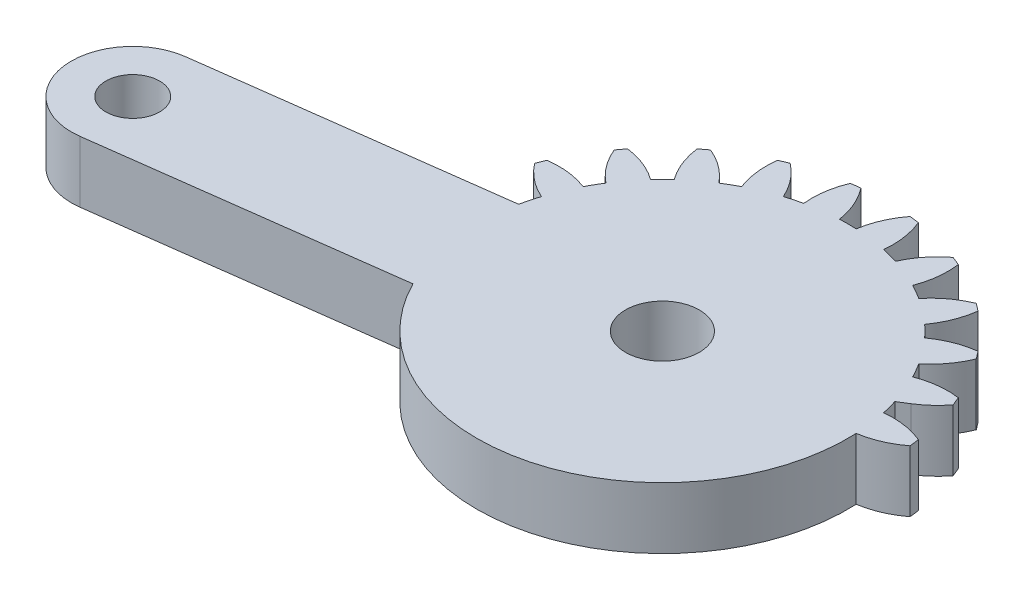
from build123d import *
from build123d.topology import SkipClean

# Parameters (mm, degrees)
SKETCH1_R           = 1.5
BOSS_EXTRUDE1_DEPTH = 4
SKETCH3_R           = 1.75
BOSS_EXTRUDE2_DEPTH = 4
CUT_EXTRUDE1_START  = -4
CUT_EXTRUDE1_DEPTH  = 4
CUT_EXTRUDE2_REACH  = 49.073
SKETCH5_R           = 2.4


with BuildPart() as part:
    # Sketch1 → Boss-Extrude1 (new body)
    with BuildSketch(Plane(origin=(0, 0, 0), x_dir=(1, 0, 0), z_dir=(0, 1, 0))):
        with BuildLine():
            Line((20.643657446, 4), (2.081641936, 4))
            ThreePointArc((2.081641936, 4), (2.861028333, 4.588201733), (3.521749436, 5.30713988))
            ThreePointArc((3.521749436, 5.30713988), (3.405395609, 5.596745198), (3.282888305, 5.883801663))
            ThreePointArc((3.282888305, 5.883801663), (1.93527598, 5.894040025), (0.627094961, 5.57027124))
            ThreePointArc((0.627094961, 5.57027124), (0.366286148, 6.046375), (0.084372603, 6.510293938))
            ThreePointArc((0.084372603, 6.510293938), (1.018855105, 7.48132754), (1.683794586, 8.65351323))
            ThreePointArc((1.683794586, 8.65351323), (1.496450048, 8.903135899), (1.303821399, 9.148703928))
            ThreePointArc((1.303821399, 9.148703928), (-0.000522033, 8.809805691), (-1.180330337, 8.158486898))
            ThreePointArc((-1.180330337, 8.158486898), (-1.555477026, 8.550865528), (-1.947855656, 8.926012217))
            ThreePointArc((-1.947855656, 8.926012217), (-1.296536862, 10.105820521), (-0.957638625, 11.410163953))
            ThreePointArc((-0.957638625, 11.410163953), (-1.203206655, 11.602792602), (-1.452829324, 11.79013714))
            ThreePointArc((-1.452829324, 11.79013714), (-2.625015014, 11.125197659), (-3.596048616, 10.190715157))
            ThreePointArc((-3.596048616, 10.190715157), (-4.059967554, 10.472628702), (-4.536071314, 10.733437515))
            ThreePointArc((-4.536071314, 10.733437515), (-4.212302529, 12.041618533), (-4.222540891, 13.389230859))
            ThreePointArc((-4.222540891, 13.389230859), (-4.509597355, 13.511738163), (-4.799202674, 13.62809199))
            ThreePointArc((-4.799202674, 13.62809199), (-5.759348103, 12.682425791), (-6.455432668, 11.528463019))
            ThreePointArc((-6.455432668, 11.528463019), (-6.976508546, 11.680699536), (-7.503891752, 11.809396783))
            ThreePointArc((-7.503891752, 11.809396783), (-7.529737283, 13.156800143), (-7.888414517, 14.455843809))
            ThreePointArc((-7.888414517, 14.455843809), (-8.197396993, 14.499881098), (-8.507248835, 14.537314892))
            ThreePointArc((-8.507248835, 14.537314892), (-9.18992168, 13.375367565), (-9.563620196, 12.080565177))
            ThreePointArc((-9.563620196, 12.080565177), (-10.106342554, 12.09275), (-10.649064912, 12.080565177))
            ThreePointArc((-10.649064912, 12.080565177), (-11.022763428, 13.375367565), (-11.705436272, 14.537314892))
            ThreePointArc((-11.705436272, 14.537314892), (-12.015288115, 14.499881098), (-12.324270591, 14.455843809))
            ThreePointArc((-12.324270591, 14.455843809), (-12.682947825, 13.156800143), (-12.708793355, 11.809396783))
            ThreePointArc((-12.708793355, 11.809396783), (-13.236176561, 11.680699536), (-13.757252439, 11.528463019))
            ThreePointArc((-13.757252439, 11.528463019), (-14.453337005, 12.682425791), (-15.413482434, 13.62809199))
            ThreePointArc((-15.413482434, 13.62809199), (-15.703087752, 13.511738163), (-15.990144217, 13.389230859))
            ThreePointArc((-15.990144217, 13.389230859), (-16.000382579, 12.041618533), (-15.676613793, 10.733437515))
            ThreePointArc((-15.676613793, 10.733437515), (-16.152717554, 10.472628702), (-16.616636492, 10.190715157))
            ThreePointArc((-16.616636492, 10.190715157), (-17.587670094, 11.125197659), (-18.759855783, 11.79013714))
            ThreePointArc((-18.759855783, 11.79013714), (-19.009478453, 11.602792602), (-19.255046482, 11.410163953))
            ThreePointArc((-19.255046482, 11.410163953), (-18.916148245, 10.105820521), (-18.264829452, 8.926012217))
            ThreePointArc((-18.264829452, 8.926012217), (-18.657208082, 8.550865528), (-19.032354771, 8.158486898))
            ThreePointArc((-19.032354771, 8.158486898), (-20.212163074, 8.809805691), (-21.516506507, 9.148703928))
            ThreePointArc((-21.516506507, 9.148703928), (-21.709135156, 8.903135899), (-21.896479694, 8.65351323))
            ThreePointArc((-21.896479694, 8.65351323), (-21.231540213, 7.48132754), (-20.297057711, 6.510293938))
            ThreePointArc((-20.297057711, 6.510293938), (-20.578971255, 6.046375), (-20.839780068, 5.57027124))
            ThreePointArc((-20.839780068, 5.57027124), (-22.147961087, 5.894040025), (-23.495573413, 5.883801663))
            ThreePointArc((-23.495573413, 5.883801663), (-23.618080717, 5.596745198), (-23.734434544, 5.30713988))
            ThreePointArc((-23.734434544, 5.30713988), (-22.788768345, 4.346994451), (-21.634805572, 3.650909885))
            ThreePointArc((-21.634805572, 3.650909885), (-21.78704209, 3.129834008), (-21.915739337, 2.602450802))
            ThreePointArc((-21.915739337, 2.602450802), (-23.263142697, 2.576605271), (-24.562186363, 2.217928037))
            ThreePointArc((-24.562186363, 2.217928037), (-24.606223651, 1.908945561), (-24.643657446, 1.599093719))
            ThreePointArc((-24.643657446, 1.599093719), (-23.481710119, 0.916420874), (-22.186907731, 0.542722358))
            ThreePointArc((-22.186907731, 0.542722358), (-22.199092554, 0), (-22.186907731, -0.542722358))
            ThreePointArc((-22.186907731, -0.542722358), (-23.481710119, -0.916420874), (-24.643657446, -1.599093719))
            ThreePointArc((-24.643657446, -1.599093719), (-24.606223651, -1.908945561), (-24.562186363, -2.217928037))
            ThreePointArc((-24.562186363, -2.217928037), (-23.263142697, -2.576605271), (-21.915739337, -2.602450802))
            ThreePointArc((-21.915739337, -2.602450802), (-21.78704209, -3.129834008), (-21.634805572, -3.650909885))
            ThreePointArc((-21.634805572, -3.650909885), (-22.788768345, -4.346994451), (-23.734434544, -5.30713988))
            ThreePointArc((-23.734434544, -5.30713988), (-23.618080717, -5.596745198), (-23.495573413, -5.883801663))
            ThreePointArc((-23.495573413, -5.883801663), (-22.147961087, -5.894040025), (-20.839780068, -5.57027124))
            ThreePointArc((-20.839780068, -5.57027124), (-20.578971255, -6.046375), (-20.297057711, -6.510293938))
            ThreePointArc((-20.297057711, -6.510293938), (-21.231540213, -7.48132754), (-21.896479694, -8.65351323))
            ThreePointArc((-21.896479694, -8.65351323), (-21.709135156, -8.903135899), (-21.516506507, -9.148703928))
            ThreePointArc((-21.516506507, -9.148703928), (-20.212163074, -8.809805691), (-19.032354771, -8.158486898))
            ThreePointArc((-19.032354771, -8.158486898), (-18.657208082, -8.550865528), (-18.264829452, -8.926012217))
            ThreePointArc((-18.264829452, -8.926012217), (-18.916148245, -10.105820521), (-19.255046482, -11.410163953))
            ThreePointArc((-19.255046482, -11.410163953), (-19.009478453, -11.602792602), (-18.759855783, -11.79013714))
            ThreePointArc((-18.759855783, -11.79013714), (-17.587670094, -11.125197659), (-16.616636492, -10.190715157))
            ThreePointArc((-16.616636492, -10.190715157), (-16.152717554, -10.472628702), (-15.676613793, -10.733437515))
            ThreePointArc((-15.676613793, -10.733437515), (-16.000382579, -12.041618533), (-15.990144217, -13.389230859))
            ThreePointArc((-15.990144217, -13.389230859), (-15.703087752, -13.511738163), (-15.413482434, -13.62809199))
            ThreePointArc((-15.413482434, -13.62809199), (-14.453337005, -12.682425791), (-13.757252439, -11.528463019))
            ThreePointArc((-13.757252439, -11.528463019), (-13.236176561, -11.680699536), (-12.708793355, -11.809396783))
            ThreePointArc((-12.708793355, -11.809396783), (-12.682947825, -13.156800143), (-12.324270591, -14.455843809))
            ThreePointArc((-12.324270591, -14.455843809), (-12.015288115, -14.499881098), (-11.705436272, -14.537314892))
            ThreePointArc((-11.705436272, -14.537314892), (-11.022763428, -13.375367565), (-10.649064912, -12.080565177))
            ThreePointArc((-10.649064912, -12.080565177), (-10.106342554, -12.09275), (-9.563620196, -12.080565177))
            ThreePointArc((-9.563620196, -12.080565177), (-9.18992168, -13.375367565), (-8.507248835, -14.537314892))
            ThreePointArc((-8.507248835, -14.537314892), (-8.197396993, -14.499881098), (-7.888414517, -14.455843809))
            ThreePointArc((-7.888414517, -14.455843809), (-7.529737283, -13.156800143), (-7.503891752, -11.809396783))
            ThreePointArc((-7.503891752, -11.809396783), (-6.976508546, -11.680699536), (-6.455432668, -11.528463019))
            ThreePointArc((-6.455432668, -11.528463019), (-5.759348103, -12.682425791), (-4.799202674, -13.62809199))
            ThreePointArc((-4.799202674, -13.62809199), (-4.509597355, -13.511738163), (-4.222540891, -13.389230859))
            ThreePointArc((-4.222540891, -13.389230859), (-4.212302529, -12.041618533), (-4.536071314, -10.733437515))
            ThreePointArc((-4.536071314, -10.733437515), (-4.059967554, -10.472628702), (-3.596048616, -10.190715157))
            ThreePointArc((-3.596048616, -10.190715157), (-2.625015014, -11.125197659), (-1.452829324, -11.79013714))
            ThreePointArc((-1.452829324, -11.79013714), (-1.203206655, -11.602792602), (-0.957638625, -11.410163953))
            ThreePointArc((-0.957638625, -11.410163953), (-1.296536862, -10.105820521), (-1.947855656, -8.926012217))
            ThreePointArc((-1.947855656, -8.926012217), (-1.555477026, -8.550865528), (-1.180330337, -8.158486898))
            ThreePointArc((-1.180330337, -8.158486898), (-0.000522033, -8.809805691), (1.303821399, -9.148703928))
            ThreePointArc((1.303821399, -9.148703928), (1.496450048, -8.903135899), (1.683794586, -8.65351323))
            ThreePointArc((1.683794586, -8.65351323), (1.018855105, -7.48132754), (0.084372603, -6.510293938))
            ThreePointArc((0.084372603, -6.510293938), (0.366286148, -6.046375), (0.627094961, -5.57027124))
            ThreePointArc((0.627094961, -5.57027124), (1.93527598, -5.894040025), (3.282888305, -5.883801663))
            ThreePointArc((3.282888305, -5.883801663), (3.405395609, -5.596745198), (3.521749436, -5.30713988))
            ThreePointArc((3.521749436, -5.30713988), (2.861028333, -4.588201733), (2.081641936, -4))
            Line((2.081641936, -4), (20.643657446, -4))
            ThreePointArc((20.643657446, -4), (24.643657446, 0), (20.643657446, 4))
        make_face()
        with Locations(Location((-10.106342554, 0, 0), (0, 0, 270))):
            Circle(SKETCH1_R, mode=Mode.SUBTRACT)
        with Locations(Location((20.643657446, 0, 0), (0, 0, 270))):
            Circle(SKETCH1_R, mode=Mode.SUBTRACT)
    extrude(amount=BOSS_EXTRUDE1_DEPTH)

    # Sketch3 → Boss-Extrude2 (add)
    with BuildSketch(Plane(origin=(0, 4, 0), x_dir=(1, 0, 0), z_dir=(0, 1, 0))):
        with BuildLine():
            ThreePointArc((-9.584237785, -3.965779445), (-14.072121999, -0.522104769), (-10.628447323, 3.965779445))
            Line((-10.628447323, 3.965779445), (-41.11537681, -0.047900965))
            ThreePointArc((-41.11537681, -0.047900965), (-44.559051487, -4.53578518), (-40.071167272, -7.979459856))
            Line((-40.071167272, -7.979459856), (-9.584237785, -3.965779445))
        make_face()
        with Locations(Location((-40.593272041, -4.013680411, 0), (0, 0, 270))):
            Circle(SKETCH3_R, mode=Mode.SUBTRACT)
    extrude(amount=-BOSS_EXTRUDE2_DEPTH)

    # Sketch4 → Cut-Extrude1 (cut)
    with SkipClean():  # the faces are left unmerged after this step: merging them gives an invalid solid
        with BuildSketch(Plane(origin=(0, 4, 0), x_dir=(1, 0, 0), z_dir=(0, 1, 0)).offset(CUT_EXTRUDE1_START)):
            with BuildLine():
                ThreePointArc((20.643657446, -4), (24.643657446, 0), (20.643657446, 4))
                Line((20.643657446, 4), (2.081641936, 4))
                Line((2.081641936, 4), (1.43808022, 3.600125745))
                ThreePointArc((1.43808022, 3.600125745), (1.581217534, 3.104116905), (1.70305423, 2.602450802))
                ThreePointArc((1.70305423, 2.602450802), (3.050457589, 2.576605271), (4.349501255, 2.217928037))
                ThreePointArc((4.349501255, 2.217928037), (4.393538544, 1.908945561), (4.430972339, 1.599093719))
                ThreePointArc((4.430972339, 1.599093719), (3.269025011, 0.916420874), (1.974222624, 0.542722358))
                ThreePointArc((1.974222624, 0.542722358), (1.70305423, -2.602450802), (0.627094961, -5.57027124))
                ThreePointArc((0.627094961, -5.57027124), (1.93527598, -5.894040025), (3.282888305, -5.883801663))
                ThreePointArc((3.282888305, -5.883801663), (3.405395609, -5.596745198), (3.521749436, -5.30713988))
                ThreePointArc((3.521749436, -5.30713988), (2.861028333, -4.588201733), (2.081641936, -4))
                Line((2.081641936, -4), (20.643657446, -4))
            make_face()
            with BuildLine():
                ThreePointArc((1.683794586, -8.65351323), (1.018855105, -7.48132754), (0.084372603, -6.510293938))
                ThreePointArc((0.084372603, -6.510293938), (-0.512518948, -7.361599771), (-1.180330337, -8.158486898))
                ThreePointArc((-1.180330337, -8.158486898), (-0.000522033, -8.809805691), (1.303821399, -9.148703928))
                ThreePointArc((1.303821399, -9.148703928), (1.496450048, -8.903135899), (1.683794586, -8.65351323))
            make_face()
            with BuildLine():
                ThreePointArc((-0.957638625, -11.410163953), (-1.296536862, -10.105820521), (-1.947855656, -8.926012217))
                ThreePointArc((-1.947855656, -8.926012217), (-2.744742783, -9.593823606), (-3.596048616, -10.190715157))
                ThreePointArc((-3.596048616, -10.190715157), (-2.625015014, -11.125197659), (-1.452829324, -11.79013714))
                ThreePointArc((-1.452829324, -11.79013714), (-1.203206655, -11.602792602), (-0.957638625, -11.410163953))
            make_face()
            with BuildLine():
                ThreePointArc((-4.222540891, -13.389230859), (-4.212302529, -12.041618533), (-4.536071314, -10.733437515))
                ThreePointArc((-4.536071314, -10.733437515), (-5.478647477, -11.172244217), (-6.455432668, -11.528463019))
                ThreePointArc((-6.455432668, -11.528463019), (-5.759348103, -12.682425791), (-4.799202674, -13.62809199))
                ThreePointArc((-4.799202674, -13.62809199), (-4.509597355, -13.511738163), (-4.222540891, -13.389230859))
            make_face()
            with BuildLine():
                ThreePointArc((-7.888414517, -14.455843809), (-7.529737283, -13.156800143), (-7.503891752, -11.809396783))
                ThreePointArc((-7.503891752, -11.809396783), (-8.527921943, -11.989294847), (-9.563620196, -12.080565177))
                ThreePointArc((-9.563620196, -12.080565177), (-9.18992168, -13.375367565), (-8.507248835, -14.537314892))
                ThreePointArc((-8.507248835, -14.537314892), (-8.197396993, -14.499881098), (-7.888414517, -14.455843809))
            make_face()
            with BuildLine():
                ThreePointArc((-11.705436272, -14.537314892), (-11.022763428, -13.375367565), (-10.649064912, -12.080565177))
                ThreePointArc((-10.649064912, -12.080565177), (-11.684763165, -11.989294847), (-12.708793355, -11.809396783))
                ThreePointArc((-12.708793355, -11.809396783), (-12.682947825, -13.156800143), (-12.324270591, -14.455843809))
                ThreePointArc((-12.324270591, -14.455843809), (-12.015288115, -14.499881098), (-11.705436272, -14.537314892))
            make_face()
            with BuildLine():
                ThreePointArc((-15.413482434, -13.62809199), (-14.453337005, -12.682425791), (-13.757252439, -11.528463019))
                ThreePointArc((-13.757252439, -11.528463019), (-14.734037631, -11.172244217), (-15.676613793, -10.733437515))
                ThreePointArc((-15.676613793, -10.733437515), (-16.000382579, -12.041618533), (-15.990144217, -13.389230859))
                ThreePointArc((-15.990144217, -13.389230859), (-15.703087752, -13.511738163), (-15.413482434, -13.62809199))
            make_face()
            with BuildLine():
                ThreePointArc((-18.759855783, -11.79013714), (-17.587670094, -11.125197659), (-16.616636492, -10.190715157))
                ThreePointArc((-16.616636492, -10.190715157), (-17.467942324, -9.593823606), (-18.264829452, -8.926012217))
                ThreePointArc((-18.264829452, -8.926012217), (-18.916148245, -10.105820521), (-19.255046482, -11.410163953))
                ThreePointArc((-19.255046482, -11.410163953), (-19.009478453, -11.602792602), (-18.759855783, -11.79013714))
            make_face()
            with BuildLine():
                ThreePointArc((-21.516506507, -9.148703928), (-20.212163074, -8.809805691), (-19.032354771, -8.158486898))
                ThreePointArc((-19.032354771, -8.158486898), (-19.70016616, -7.361599771), (-20.297057711, -6.510293938))
                ThreePointArc((-20.297057711, -6.510293938), (-21.231540213, -7.48132754), (-21.896479694, -8.65351323))
                ThreePointArc((-21.896479694, -8.65351323), (-21.709135156, -8.903135899), (-21.516506507, -9.148703928))
            make_face()
            with BuildLine():
                ThreePointArc((-21.942853375, 2.47620963), (-21.92946485, 2.539366405), (-21.915739337, 2.602450802))
                ThreePointArc((-21.915739337, 2.602450802), (-23.263142697, 2.576605271), (-24.562186363, 2.217928037))
                ThreePointArc((-24.562186363, 2.217928037), (-24.56889027, 2.173784387), (-24.575459377, 2.129620475))
                Line((-24.575459377, 2.129620475), (-21.942853375, 2.47620963))
            make_face()
            with BuildLine():
                ThreePointArc((-23.495573413, -5.883801663), (-22.147961087, -5.894040025), (-20.839780068, -5.57027124))
                ThreePointArc((-20.839780068, -5.57027124), (-20.869365339, -5.512888815), (-20.898643838, -5.455349261))
                Line((-20.898643838, -5.455349261), (-23.531249839, -5.801938416))
                ThreePointArc((-23.531249839, -5.801938416), (-23.513474108, -5.842897269), (-23.495573413, -5.883801663))
            make_face()
        extrude(amount=CUT_EXTRUDE1_DEPTH, mode=Mode.SUBTRACT)

    # Sketch5 → Cut-Extrude2 (cut, up to next)
    with BuildSketch(Plane(origin=(0, 4, 0), x_dir=(1, 0, 0), z_dir=(0, 1, 0)), mode=Mode.PRIVATE) as cut_extrude2_sk1:
        with Locations(Location((-10.106342554, 0, 0), (0, 0, 270))):
            Circle(SKETCH5_R)
    cut_extrude2_tool1 = extrude(cut_extrude2_sk1.sketch, amount=-CUT_EXTRUDE2_REACH, mode=Mode.PRIVATE) & part.part
    add(cut_extrude2_tool1.solids().sort_by_distance((-10.106343, 4, 0))[0], mode=Mode.SUBTRACT)


solid = part.part
